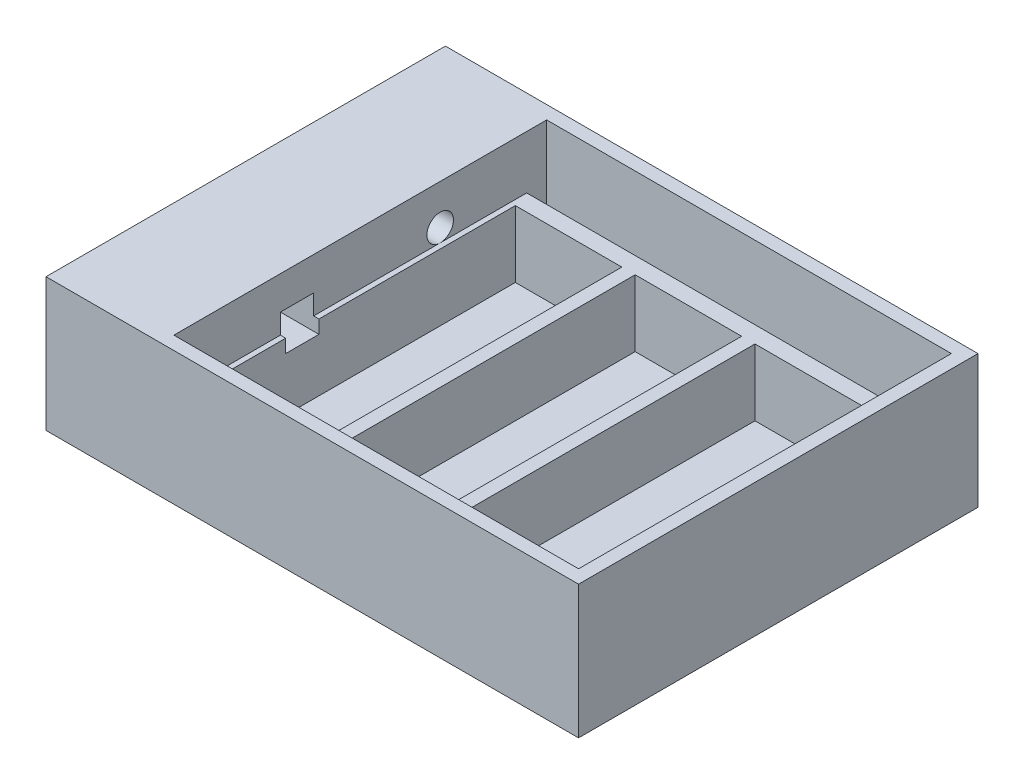
from build123d import *

# Parameters (mm, degrees)
SKETCH1_W           = 101.6
SKETCH1_H           = 76.2
BOSS_EXTRUDE1_DEPTH = 25.4
SKETCH2_W           = 77.204847721
SKETCH2_H           = 71.12
CUT_EXTRUDE1_DEPTH  = 22.86
SKETCH3_W           = 73.394847721
SKETCH3_H           = 63.5
BOSS_EXTRUDE3_DEPTH = 12.7
SKETCH4_W           = 38.1
SKETCH4_H           = 15.24
CUT_EXTRUDE2_DEPTH  = 6.35
SKETCH7_R           = 2.535464608
CUT_EXTRUDE3_DEPTH  = 22.86
SKETCH8_W           = 6.35
SKETCH8_H           = 6.35
CUT_EXTRUDE5_DEPTH  = 17.78
SKETCH9_W           = 20.32
SKETCH9_H           = 57.15
CUT_EXTRUDE6_DEPTH  = 12.7
LPATTERN1_COUNT     = 3
LPATTERN1_PITCH     = 22.86


with BuildPart() as part:
    # Sketch1 → Boss-Extrude1 (new body)
    with BuildSketch(Plane(origin=(0, 0, 0), x_dir=(1, 0, 0), z_dir=(0, 1, 0))):
        with Locations((5.940322581, -3.37983871)):
            Rectangle(SKETCH1_W, SKETCH1_H)
    extrude(amount=BOSS_EXTRUDE1_DEPTH)

    # Sketch2 → Cut-Extrude1 (cut)
    with BuildSketch(Plane(origin=(0, 25.4, 0), x_dir=(1, 0, 0), z_dir=(0, 1, 0))):
        with Locations((15.59789872, -3.37983871)):
            Rectangle(SKETCH2_W, SKETCH2_H)
    extrude(amount=-CUT_EXTRUDE1_DEPTH, mode=Mode.SUBTRACT)

    # Sketch3 → Boss-Extrude3 (add)
    with BuildSketch(Plane(origin=(0, 2.54, 0), x_dir=(1, 0, 0), z_dir=(0, 1, 0))):
        with Locations((13.692898721, -3.37983871)):
            Rectangle(SKETCH3_W, SKETCH3_H)
    extrude(amount=BOSS_EXTRUDE3_DEPTH)

    # Sketch4 → Cut-Extrude2 (cut)
    with BuildSketch(Plane.ZY.offset(44.859677419)):
        with Locations((3.37983871, 13.97)):
            Rectangle(SKETCH4_W, SKETCH4_H)
    extrude(amount=-CUT_EXTRUDE2_DEPTH, mode=Mode.SUBTRACT)

    # Sketch7 → Cut-Extrude3 (cut)
    with BuildSketch(Plane.ZY.offset(44.859677419)):
        with Locations((-11.86016129, 17.78)):
            Circle(SKETCH7_R)
    extrude(amount=-CUT_EXTRUDE3_DEPTH, mode=Mode.SUBTRACT)

    # Sketch8 → Cut-Extrude5 (cut)
    with BuildSketch(Plane.ZY.offset(38.509677419)):
        with Locations((15.44483871, 15.875)):
            Rectangle(SKETCH8_W, SKETCH8_H)
    extrude(amount=-CUT_EXTRUDE5_DEPTH, mode=Mode.SUBTRACT)

    # Sketch9 → Cut-Extrude6 (cut)
    with BuildSketch(Plane(origin=(0, 15.24, 0), x_dir=(1, 0, 0), z_dir=(0, 1, 0))):
        with Locations((33.880322581, -3.37983871)):
            Rectangle(SKETCH9_W, SKETCH9_H)
    cut_extrude6 = extrude(amount=-CUT_EXTRUDE6_DEPTH, mode=Mode.SUBTRACT)

    # LPattern1: Cut-Extrude6 ×3
    with Locations(*[(-i * LPATTERN1_PITCH, 0, 0) for i in range(1, LPATTERN1_COUNT)]):
        add(cut_extrude6, mode=Mode.SUBTRACT)


solid = part.part
